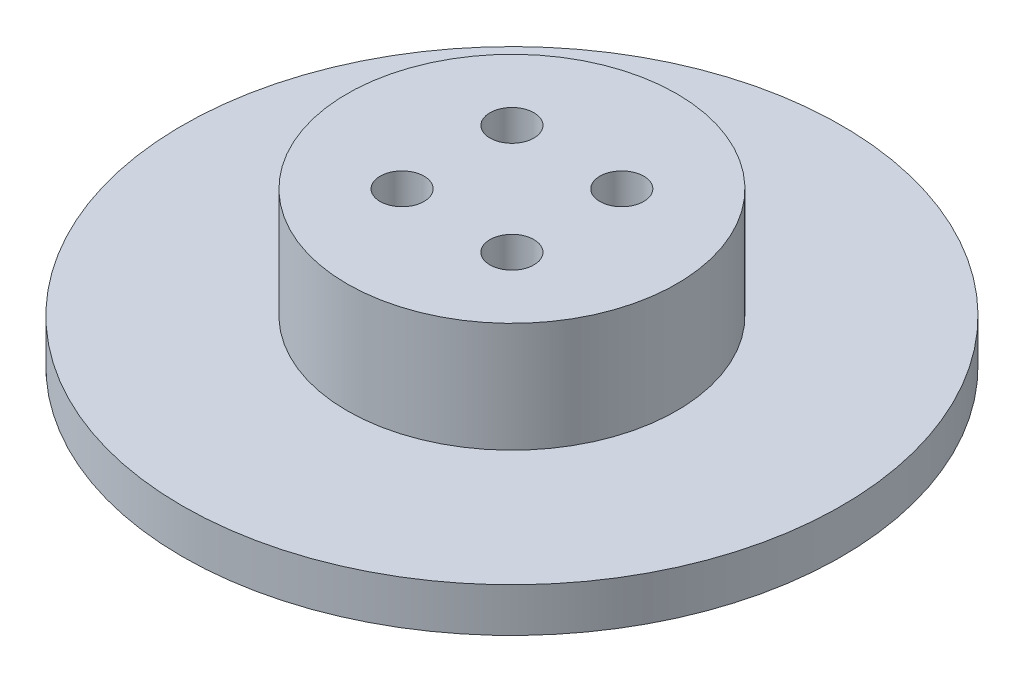
from build123d import *

# Parameters (mm, degrees)
SKETCH1_R           = 30
BOSS_EXTRUDE1_DEPTH = 4
SKETCH2_R           = 15
BOSS_EXTRUDE2_DEPTH = 10
SKETCH3_R           = 3
BOSS_EXTRUDE3_DEPTH = 4
SKETCH4_R           = 2
CUT_EXTRUDE1_DEPTH  = 4


with BuildPart() as part:
    # Sketch1 → Boss-Extrude1 (new body)
    with BuildSketch(Plane(origin=(0, 0, 0), x_dir=(1, 0, 0), z_dir=(0, 1, 0))):
        with Locations(Location((0, 0, 0), (0, 0, 270))):
            Circle(SKETCH1_R)
    extrude(amount=BOSS_EXTRUDE1_DEPTH)

    # Sketch2 → Boss-Extrude2 (add)
    with BuildSketch(Plane(origin=(0, 4, 0), x_dir=(1, 0, 0), z_dir=(0, 1, 0))):
        with Locations(Location((0, 0, 0), (0, 0, 270))):
            Circle(SKETCH2_R)
    extrude(amount=BOSS_EXTRUDE2_DEPTH)

    # Sketch3 → Boss-Extrude3 (add)
    with BuildSketch(Plane.XZ):
        with Locations(Location((-21, 0, 0), (0, 0, 90))):
            Circle(SKETCH3_R)
        with Locations(Location((0, 21, 0), (0, 0, 90))):
            Circle(SKETCH3_R)
        with Locations(Location((21, 0, 0), (0, 0, 90))):
            Circle(SKETCH3_R)
        with Locations(Location((0, -21, 0), (0, 0, 90))):
            Circle(SKETCH3_R)
    extrude(amount=BOSS_EXTRUDE3_DEPTH)

    # Sketch4 → Cut-Extrude1 (cut)
    with BuildSketch(Plane(origin=(0, 14, 0), x_dir=(1, 0, 0), z_dir=(0, 1, 0))):
        with Locations(Location((-5, 5, 0), (0, 0, 270))):
            Circle(SKETCH4_R)
        with Locations(Location((5, 5, 0), (0, 0, 270))):
            Circle(SKETCH4_R)
        with Locations(Location((5, -5, 0), (0, 0, 270))):
            Circle(SKETCH4_R)
        with Locations(Location((-5, -5, 0), (0, 0, 270))):
            Circle(SKETCH4_R)
    extrude(amount=-CUT_EXTRUDE1_DEPTH, mode=Mode.SUBTRACT)


solid = part.part
